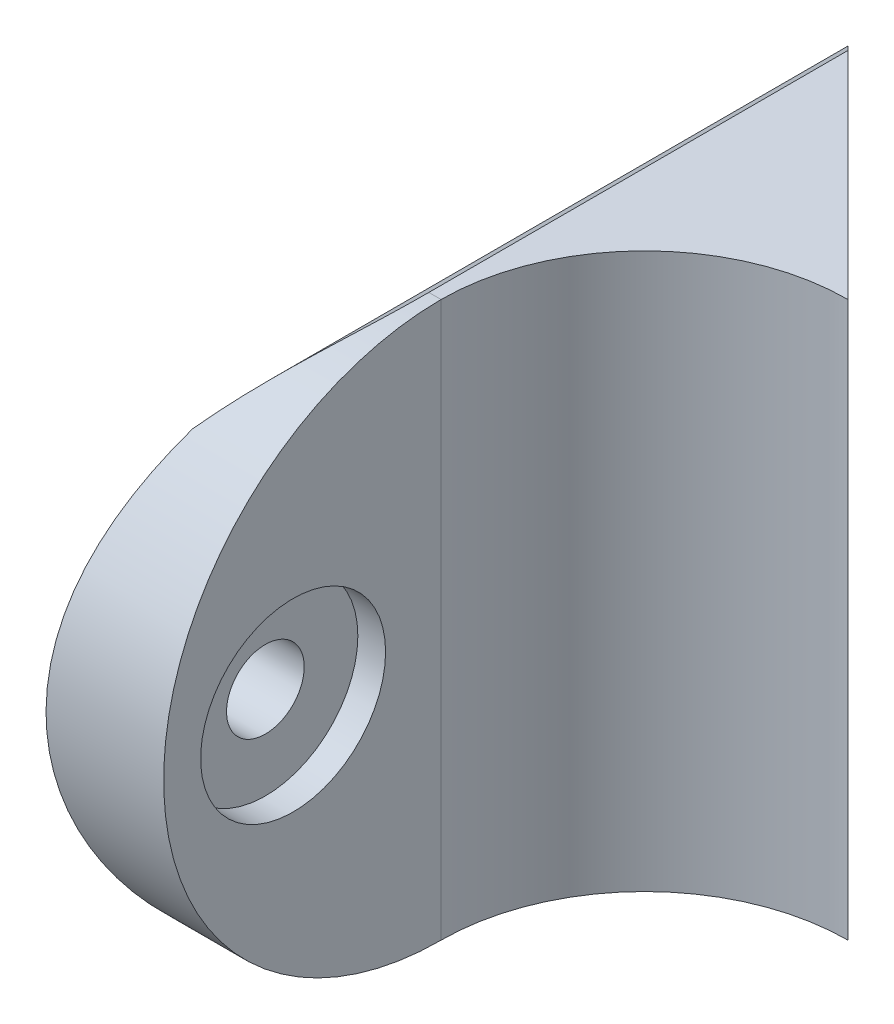
from build123d import *

# Parameters (mm, degrees)
BOSS_EXTRUDE1_DEPTH     = 50
CUT_EXTRUDE1_DEPTH      = 56.012411105
CUT_EXTRUDE1_DEPTH_BACK = 56.012411105
SKETCH3_R               = 11.25
CUT_EXTRUDE2_DEPTH      = 7
CUT_EXTRUDE3_DEPTH      = 24
CUT_EXTRUDE3_DEPTH_BACK = 3
SKETCH5_R               = 2
CUT_EXTRUDE4_DEPTH      = 56.012411105
CUT_EXTRUDE4_DEPTH_BACK = 56.012411105
CUT_EXTRUDE5_DEPTH      = 3
CUT_EXTRUDE5_DEPTH_BACK = 15
SKETCH7_R               = 2.5
CUT_EXTRUDE7_DEPTH      = 10
CUT_EXTRUDE7_DEPTH_BACK = 1
CUT_EXTRUDE8_DEPTH      = 10
SKETCH11_R              = 2.1
CUT_EXTRUDE9_DEPTH      = 10
SKETCH12_R              = 5
CUT_EXTRUDE10_DEPTH     = 1.5


with BuildPart() as part:
    # Sketch1 → Boss-Extrude1 (new body)
    with BuildSketch(Plane.XY):
        with BuildLine():
            Line((-11.66190379, -15), (11.66190379, -15))
            ThreePointArc((11.66190379, -15), (13.435028843, -13.435028843), (15, -11.66190379))
            ThreePointArc((15, -11.66190379), (17.359878328, 0), (15, 11.66190379))
            ThreePointArc((15, 11.66190379), (13.435028843, 13.435028843), (11.66190379, 15))
            Line((11.66190379, 15), (-11.66190379, 15))
            ThreePointArc((-11.66190379, 15), (-13.435028843, 13.435028843), (-15, 11.66190379))
            ThreePointArc((-15, 11.66190379), (-17.359878328, 0), (-15, -11.66190379))
            ThreePointArc((-15, -11.66190379), (-13.435028843, -13.435028843), (-11.66190379, -15))
        make_face()
    extrude(amount=BOSS_EXTRUDE1_DEPTH)

    # Sketch2 → Cut-Extrude1 (cut, two sides: drawn at the far end of the back side and taken through both)
    with BuildSketch(Plane(origin=(0, 0, 0), x_dir=(1, 0, 0), z_dir=(0, 1, 0)).offset(-CUT_EXTRUDE1_DEPTH_BACK)):
        with BuildLine():
            Line((-11, -35), (-11, -50))
            Line((-11, -50), (11, -50))
            Line((11, -50), (11, -35))
            ThreePointArc((11, -35), (0, -24), (-11, -35))
        make_face()
    extrude(amount=CUT_EXTRUDE1_DEPTH + CUT_EXTRUDE1_DEPTH_BACK, mode=Mode.SUBTRACT)

    # Sketch3 → Cut-Extrude2 (cut)
    with BuildSketch(Plane(origin=(0, 0, 0), x_dir=(-1, 0, 0), z_dir=(0, 0, -1))):
        Circle(SKETCH3_R)
    extrude(amount=-CUT_EXTRUDE2_DEPTH, mode=Mode.SUBTRACT)

    # Sketch4 → Cut-Revolve1 (revolve, cut)
    with BuildSketch(Plane(origin=(0, 0, 0), x_dir=(1, 0, 0), z_dir=(0, 1, 0)), mode=Mode.PRIVATE) as cut_revolve1_sk:
        Polygon((0, -7), (9, -7), (0, -9), align=None)
    revolve(cut_revolve1_sk.sketch.rotate(Axis((0, 0, 9), (0, 0, -1)), 180), axis=Axis((0, 0, 9), (0, 0, -1)), mode=Mode.SUBTRACT)

    # Sketch5 → Cut-Extrude3 (cut, two sides: drawn at the far end of the back side and taken through both)
    with BuildSketch(Plane.ZY.offset(-11).offset(-CUT_EXTRUDE3_DEPTH_BACK)):
        with Locations((43, 0)):
            Circle(SKETCH5_R)
    extrude(amount=CUT_EXTRUDE3_DEPTH + CUT_EXTRUDE3_DEPTH_BACK, mode=Mode.SUBTRACT)

    # Sketch6 → Cut-Extrude4 (cut, two sides: drawn at the far end of the back side and taken through both)
    with BuildSketch(Plane(origin=(0, 0, 0), x_dir=(1, 0, 0), z_dir=(0, 1, 0)).offset(-CUT_EXTRUDE4_DEPTH_BACK)):
        Polygon((0, -24), (-19.504315736, -4.495684264), (-19.504315736, 1.223091499), (17.994194722, 1.223091499), (17.994194722, -52.44895982), (0, -52.44895982), align=None)
    extrude(amount=CUT_EXTRUDE4_DEPTH + CUT_EXTRUDE4_DEPTH_BACK, mode=Mode.SUBTRACT)

    # Sketch7 → Cut-Extrude5 (cut, two sides: drawn at the far end of the back side and taken through both)
    with BuildSketch(Plane(origin=(0, 0, 0), x_dir=(0, 0, -1), z_dir=(1, 0, 0)).offset(-CUT_EXTRUDE5_DEPTH_BACK)):
        with Locations((-18, 6)):
            Circle(SKETCH7_R)
        with Locations(Location((-18, -6, 0), (0, 0, 180))):
            Circle(SKETCH7_R)
    extrude(amount=CUT_EXTRUDE5_DEPTH + CUT_EXTRUDE5_DEPTH_BACK, mode=Mode.SUBTRACT)

    # Sketch9 → Cut-Extrude7 (cut, two sides: drawn at the far end of the back side and taken through both)
    with BuildSketch(Plane.ZY.offset(15).offset(-CUT_EXTRUDE7_DEPTH_BACK)):
        with BuildLine():
            Line((13, 6), (13, -6))
            ThreePointArc((13, -6), (18, -11), (23, -6))
            Line((23, -6), (23, 6))
            ThreePointArc((23, 6), (18, 11), (13, 6))
        make_face()
    extrude(amount=CUT_EXTRUDE7_DEPTH + CUT_EXTRUDE7_DEPTH_BACK, mode=Mode.SUBTRACT)

    # Sketch10 → Cut-Extrude8 (cut)
    with BuildSketch(Plane(origin=(-11, 0, 0), x_dir=(0, 0, -1), z_dir=(1, 0, 0))):
        with BuildLine():
            Line((-35, 15), (-35, 16.580470579))
            Line((-35, 16.580470579), (-52.035721035, 16.580470579))
            Line((-52.035721035, 16.580470579), (-52.035721035, -15.90001351))
            Line((-52.035721035, -15.90001351), (-35, -15.90001351))
            Line((-35, -15.90001351), (-35, -15))
            ThreePointArc((-35, -15), (-50, 0), (-35, 15))
        make_face()
    extrude(amount=-CUT_EXTRUDE8_DEPTH, mode=Mode.SUBTRACT)

    # Sketch11 → Cut-Extrude9 (cut)
    with BuildSketch(Plane(origin=(-11, 0, 0), x_dir=(0, 0, -1), z_dir=(1, 0, 0))):
        with Locations((-43, 0)):
            Circle(SKETCH11_R)
    extrude(amount=-CUT_EXTRUDE9_DEPTH, mode=Mode.SUBTRACT)

    # Sketch12 → Cut-Extrude10 (cut)
    with BuildSketch(Plane(origin=(-11, 0, 0), x_dir=(0, 0, -1), z_dir=(1, 0, 0))):
        with Locations((-43, 0)):
            Circle(SKETCH12_R)
    extrude(amount=-CUT_EXTRUDE10_DEPTH, mode=Mode.SUBTRACT)


solid = part.part
